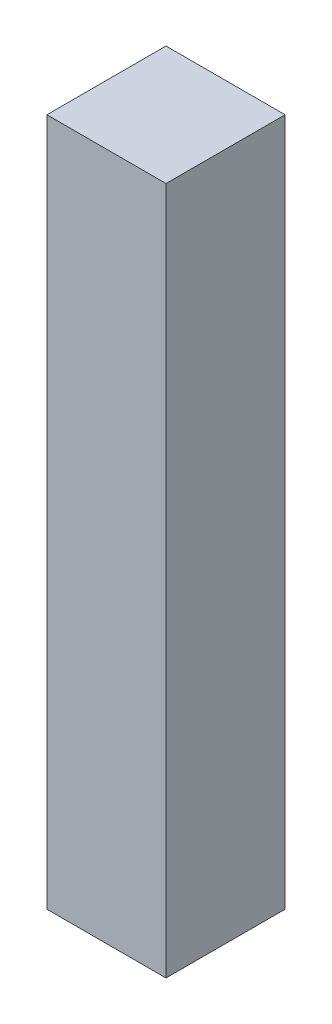
from build123d import *

# Parameters (mm, degrees)
SKETCH1_W           = 114.3
SKETCH1_H           = 114.3
BOSS_EXTRUDE1_DEPTH = 660.4
SKETCH2_R           = 3.96875
CUT_EXTRUDE1_DEPTH  = 25.4


with BuildPart() as part:
    # Sketch1 → Boss-Extrude1 (new body)
    with BuildSketch(Plane(origin=(0, 0, 0), x_dir=(1, 0, 0), z_dir=(0, 1, 0))):
        Rectangle(SKETCH1_W, SKETCH1_H)
    extrude(amount=BOSS_EXTRUDE1_DEPTH)

    # Sketch2 → Cut-Extrude1 (cut)
    with BuildSketch(Plane(origin=(0, 0, 0), x_dir=(1, 0, 0), z_dir=(0, 1, 0))):
        with Locations(Location((0, 0, 0), (0, 0, 270))):
            Circle(SKETCH2_R)
    extrude(amount=CUT_EXTRUDE1_DEPTH, mode=Mode.SUBTRACT)


solid = part.part
